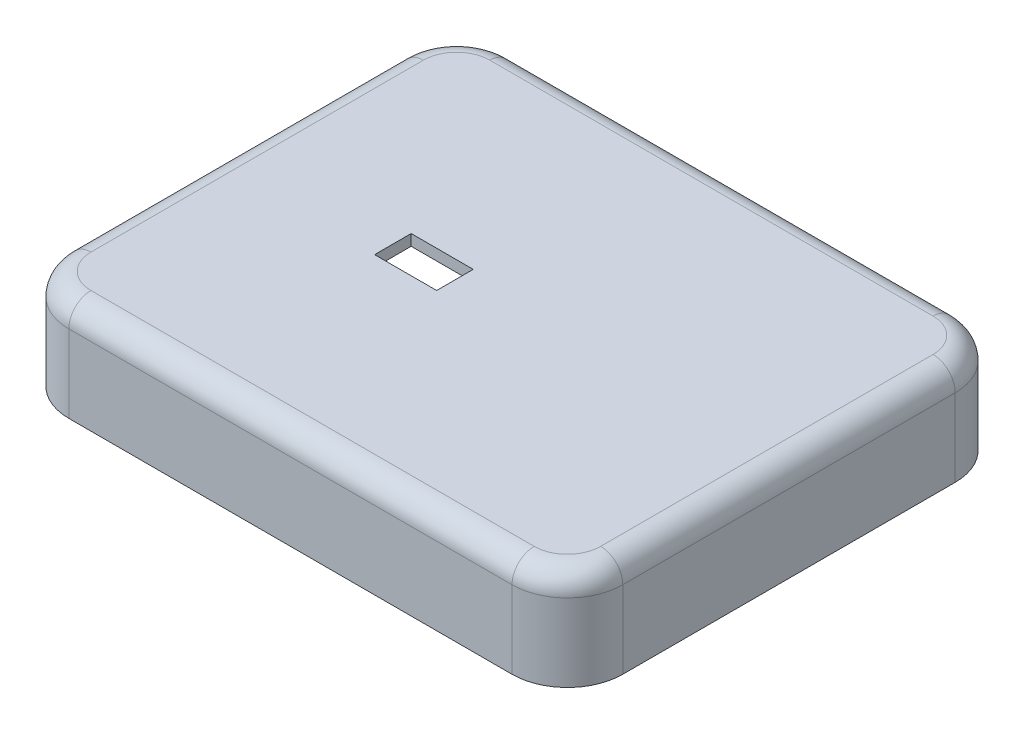
from build123d import *

# Parameters (mm, degrees)
BOSS_EXTRUDE1_DEPTH = 9
FILLET1_R           = 2
CUT_EXTRUDE1_DEPTH  = 7
SKETCH3_R           = 1.1
CUT_EXTRUDE2_DEPTH  = 6
SKETCH4_W           = 5.6
SKETCH4_H           = 3.3
CUT_EXTRUDE3_DEPTH  = 46.366235587
SKETCH5_W           = 7.6
SKETCH5_H           = 5.3
CUT_EXTRUDE4_DEPTH  = 1
SKETCH6_R           = 1.2
BOSS_EXTRUDE2_DEPTH = 3.5
CUT_EXTRUDE5_DEPTH  = 3.5
SKETCH9_R           = 1.2
SKETCH9_W           = 1.831616398
SKETCH9_H           = 3.192245721
SKETCH9_W_2         = 1.831616397
BOSS_EXTRUDE3_DEPTH = 3.5
SKETCH10_W          = 17.2
SKETCH10_H          = 21.10187295
CUT_EXTRUDE7_DEPTH  = 3.5
CUT_EXTRUDE8_DEPTH  = 3.5


with BuildPart() as part:
    # Sketch1 → Boss-Extrude1 (new body)
    with BuildSketch(Plane(origin=(0, 0, 0), x_dir=(1, 0, 0), z_dir=(0, 1, 0))):
        with BuildLine():
            Line((-34.540816327, 21.109693878), (5.459183673, 21.109693878))
            ThreePointArc((5.459183673, 21.109693878), (8.994717579, 19.645227783), (10.459183673, 16.109693878))
            Line((10.459183673, 16.109693878), (10.459183673, -13.890306122))
            ThreePointArc((10.459183673, -13.890306122), (8.994717579, -17.425840028), (5.459183673, -18.890306122))
            Line((5.459183673, -18.890306122), (-34.540816327, -18.890306122))
            ThreePointArc((-34.540816327, -18.890306122), (-38.076350232, -17.425840028), (-39.540816327, -13.890306122))
            Line((-39.540816327, -13.890306122), (-39.540816327, 16.109693878))
            ThreePointArc((-39.540816327, 16.109693878), (-38.076350232, 19.645227783), (-34.540816327, 21.109693878))
        make_face()
    extrude(amount=BOSS_EXTRUDE1_DEPTH)

    # Fillet1
    fillet1_edges = [part.edges().sort_by_distance(p)[0] for p in [
        (8.994717579, 9, -19.645227783),
        (-14.540816327, 9, -21.109693878),
        (-38.076350232, 9, -19.645227783),
        (-39.540816327, 9, -1.109693878),
        (-38.076350232, 9, 17.425840028),
        (-14.540816327, 9, 18.890306122),
        (8.994717579, 9, 17.425840028),
        (10.459183673, 9, -1.109693878),
    ]]
    fillet(fillet1_edges, radius=FILLET1_R)

    # Sketch2 → Cut-Extrude1 (cut)
    with BuildSketch(Plane.XZ):
        with BuildLine():
            Line((-32.140816327, 16.490306122), (3.059183673, 16.490306122))
            ThreePointArc((3.059183673, 16.490306122), (6.594717579, 15.025840028), (8.059183673, 11.490306122))
            Line((8.059183673, 11.490306122), (8.059183673, -13.709693878))
            ThreePointArc((8.059183673, -13.709693878), (6.594717579, -17.245227783), (3.059183673, -18.709693878))
            Line((3.059183673, -18.709693878), (-32.140816327, -18.709693878))
            ThreePointArc((-32.140816327, -18.709693878), (-35.676350232, -17.245227783), (-37.140816327, -13.709693878))
            Line((-37.140816327, -13.709693878), (-37.140816327, 11.490306122))
            ThreePointArc((-37.140816327, 11.490306122), (-35.676350232, 15.025840028), (-32.140816327, 16.490306122))
        make_face()
    extrude(amount=-CUT_EXTRUDE1_DEPTH, mode=Mode.SUBTRACT)

    # Sketch3 → Cut-Extrude2 (cut)
    with BuildSketch(Plane.XZ):
        with Locations(Location((7.659183673, 16.090306122, 0), (0, 0, 270))):
            Circle(SKETCH3_R)
        with Locations(Location((-36.740816327, 16.090306122, 0), (0, 0, 270))):
            Circle(SKETCH3_R)
        with Locations(Location((-36.740816327, -18.309693878, 0), (0, 0, 270))):
            Circle(SKETCH3_R)
        with Locations(Location((7.659183673, -18.309693878, 0), (0, 0, 270))):
            Circle(SKETCH3_R)
    extrude(amount=-CUT_EXTRUDE2_DEPTH, mode=Mode.SUBTRACT)

    # Sketch4 → Cut-Extrude3 (cut, through all)
    with BuildSketch(Plane.XZ.offset(-7)):
        with Locations((-21.740816327, -0.359693878)):
            Rectangle(SKETCH4_W, SKETCH4_H)
    extrude(amount=-CUT_EXTRUDE3_DEPTH, mode=Mode.SUBTRACT)

    # Sketch5 → Cut-Extrude4 (cut)
    with BuildSketch(Plane.XZ.offset(-7)):
        with Locations((-21.740816327, -0.359693878)):
            Rectangle(SKETCH5_W, SKETCH5_H)
    extrude(amount=-CUT_EXTRUDE4_DEPTH, mode=Mode.SUBTRACT)

    # Sketch6 → Boss-Extrude2 (add)
    with BuildSketch(Plane.XZ.offset(-7)):
        with Locations(Location((-17.440816327, 6.640306122, 0), (0, 0, 270))):
            Circle(SKETCH6_R)
        with Locations(Location((-31.440816327, 6.640306122, 0), (0, 0, 270))):
            Circle(SKETCH6_R)
        with Locations(Location((-31.440816327, -7.359693878, 0), (0, 0, 270))):
            Circle(SKETCH6_R)
        with Locations(Location((-17.440816327, -7.359693878, 0), (0, 0, 270))):
            Circle(SKETCH6_R)
    extrude(amount=BOSS_EXTRUDE2_DEPTH)

    # Sketch7 → Cut-Extrude5 (cut)
    with BuildSketch(Plane.XZ.offset(-3.5)):
        with BuildLine():
            Line((-30.440816327, 6.640306122), (-18.440816327, 6.640306122))
            ThreePointArc((-18.440816327, 6.640306122), (-17.733709545, 6.347412904), (-17.440816327, 5.640306122))
            Line((-17.440816327, 5.640306122), (-17.440816327, -6.206359886))
            ThreePointArc((-17.440816327, -6.206359886), (-17.733709545, -6.913466667), (-18.440816327, -7.206359886))
            Line((-18.440816327, -7.206359886), (-30.440816327, -7.206359886))
            ThreePointArc((-30.440816327, -7.206359886), (-31.147923108, -6.913466667), (-31.440816327, -6.206359886))
            Line((-31.440816327, -6.206359886), (-31.440816327, 5.640306122))
            ThreePointArc((-31.440816327, 5.640306122), (-31.147923108, 6.347412904), (-30.440816327, 6.640306122))
        make_face()
    extrude(amount=-CUT_EXTRUDE5_DEPTH, mode=Mode.SUBTRACT)

    # Sketch9 → Boss-Extrude3 (add)
    with BuildSketch(Plane.XZ.offset(-7)):
        with Locations(Location((3.059183673, 9.290306122, 0), (0, 0, 270))):
            Circle(SKETCH9_R)
        with Locations(Location((-14.140816327, 9.290306122, 0), (0, 0, 270))):
            Circle(SKETCH9_R)
        with Locations((-14.344094184, -10.215443968)):
            Rectangle(SKETCH9_W, SKETCH9_H)
        with Locations((3.487522214, -10.215443968)):
            Rectangle(SKETCH9_W_2, SKETCH9_H)
    extrude(amount=BOSS_EXTRUDE3_DEPTH)

    # Sketch10 → Cut-Extrude7 (cut)
    with BuildSketch(Plane.XZ.offset(-3.5)):
        with Locations((-5.540816327, -1.260630353)):
            Rectangle(SKETCH10_W, SKETCH10_H)
    extrude(amount=-CUT_EXTRUDE7_DEPTH, mode=Mode.SUBTRACT)

    # Sketch11 → Cut-Extrude8 (cut)
    with BuildSketch(Plane.XY.offset(-18.709693878)):
        with BuildLine():
            Line((-9.540816327, 7.15), (-1.540816327, 7.15))
            ThreePointArc((-1.540816327, 7.15), (-1.187262936, 7.003553391), (-1.040816327, 6.65))
            Line((-1.040816327, 6.65), (-1.040816327, 4.25))
            ThreePointArc((-1.040816327, 4.25), (-1.187262936, 3.896446609), (-1.540816327, 3.75))
            Line((-1.540816327, 3.75), (-9.540816327, 3.75))
            ThreePointArc((-9.540816327, 3.75), (-9.894369717, 3.896446609), (-10.040816327, 4.25))
            Line((-10.040816327, 4.25), (-10.040816327, 6.65))
            ThreePointArc((-10.040816327, 6.65), (-9.894369717, 7.003553391), (-9.540816327, 7.15))
        make_face()
    extrude(amount=-CUT_EXTRUDE8_DEPTH, mode=Mode.SUBTRACT)


solid = part.part
